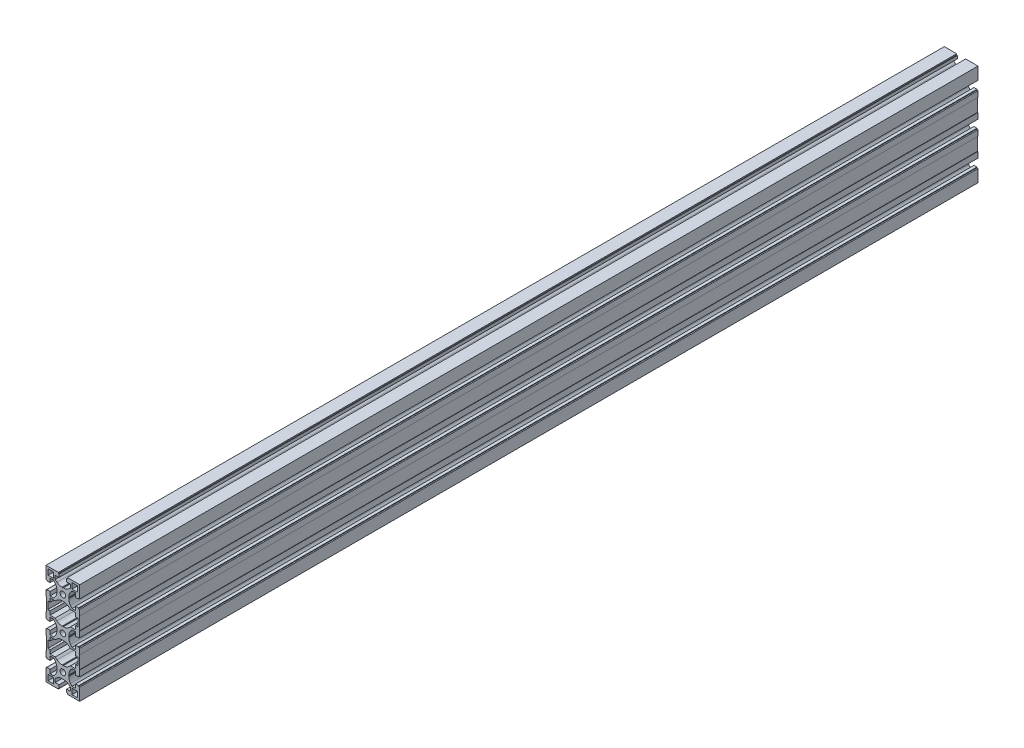
from build123d import *

# Parameters (mm, degrees)
MODEL_R             = 3.7
MODEL_W             = 7.5
MODEL_H             = 7.5
BOSS_EXTRUDE1_DEPTH = 1200


with BuildPart() as part:
    # Model → Boss-Extrude1 (new body)
    with BuildSketch(Plane.XY):
        with BuildLine():
            Line((-12.229898987, -10.25), (-10.212991588, -7.746686356))
            ThreePointArc((-10.212991588, -7.746686356), (-8.56946226, -4.799135414), (-8, -1.472732261))
            Line((-8, -1.472732261), (-8, -0.5))
            Line((-8, -0.5), (-7.5, 0))
            Line((-7.5, 0), (-8, 0.5))
            Line((-8, 0.5), (-8, 1.472732261))
            ThreePointArc((-8, 1.472732261), (-8.56946226, 4.799135414), (-10.212991588, 7.746686356))
            Line((-10.212991588, 7.746686356), (-12.229898987, 10.25))
            Line((-12.229898987, 10.25), (-17, 10.25))
            Line((-17, 10.25), (-17, 5.1))
            Line((-17, 5.1), (-21, 5.1))
            Line((-21, 5.1), (-21, 6))
            Line((-21, 6), (-22.5, 6))
            Line((-22.5, 6), (-22.5, 13.75))
            Line((-22.5, 13.75), (-22, 13.75))
            Line((-22, 13.75), (-22, 31.25))
            Line((-22, 31.25), (-22.5, 31.25))
            Line((-22.5, 31.25), (-22.5, 39))
            Line((-22.5, 39), (-21, 39))
            Line((-21, 39), (-21, 39.9))
            Line((-21, 39.9), (-17, 39.9))
            Line((-17, 39.9), (-17, 34.75))
            Line((-17, 34.75), (-12.229898987, 34.75))
            Line((-12.229898987, 34.75), (-10.212991588, 37.253313644))
            ThreePointArc((-10.212991588, 37.253313644), (-8.56946226, 40.200864586), (-8, 43.527267739))
            Line((-8, 43.527267739), (-8, 44.5))
            Line((-8, 44.5), (-7.5, 45))
            Line((-7.5, 45), (-8, 45.5))
            Line((-8, 45.5), (-8, 46.472732261))
            ThreePointArc((-8, 46.472732261), (-8.56946226, 49.799135414), (-10.212991588, 52.746686356))
            Line((-10.212991588, 52.746686356), (-12.229898987, 55.25))
            Line((-12.229898987, 55.25), (-17, 55.25))
            Line((-17, 55.25), (-17, 50.1))
            Line((-17, 50.1), (-21, 50.1))
            Line((-21, 50.1), (-21, 51))
            Line((-21, 51), (-22.5, 51))
            Line((-22.5, 51), (-22.5, 67.5))
            Line((-22.5, 67.5), (-6, 67.5))
            Line((-6, 67.5), (-6, 66))
            Line((-6, 66), (-5.1, 66))
            Line((-5.1, 66), (-5.1, 62))
            Line((-5.1, 62), (-10.25, 62))
            Line((-10.25, 62), (-10.25, 57.229898987))
            Line((-10.25, 57.229898987), (-7.746686356, 55.212991588))
            ThreePointArc((-7.746686356, 55.212991588), (-4.799135414, 53.56946226), (-1.472732261, 53))
            Line((-1.472732261, 53), (-0.5, 53))
            Line((-0.5, 53), (0, 52.5))
            Line((0, 52.5), (0.5, 53))
            Line((0.5, 53), (1.472732261, 53))
            ThreePointArc((1.472732261, 53), (4.799135414, 53.56946226), (7.746686356, 55.212991588))
            Line((7.746686356, 55.212991588), (10.25, 57.229898987))
            Line((10.25, 57.229898987), (10.25, 62))
            Line((10.25, 62), (5.1, 62))
            Line((5.1, 62), (5.1, 66))
            Line((5.1, 66), (6, 66))
            Line((6, 66), (6, 67.5))
            Line((6, 67.5), (22.5, 67.5))
            Line((22.5, 67.5), (22.5, 51))
            Line((22.5, 51), (21, 51))
            Line((21, 51), (21, 50.1))
            Line((21, 50.1), (17, 50.1))
            Line((17, 50.1), (17, 55.25))
            Line((17, 55.25), (12.229898987, 55.25))
            Line((12.229898987, 55.25), (10.212991588, 52.746686356))
            ThreePointArc((10.212991588, 52.746686356), (8.56946226, 49.799135414), (8, 46.472732261))
            Line((8, 46.472732261), (8, 45.5))
            Line((8, 45.5), (7.5, 45))
            Line((7.5, 45), (8, 44.5))
            Line((8, 44.5), (8, 43.527267739))
            ThreePointArc((8, 43.527267739), (8.56946226, 40.200864586), (10.212991588, 37.253313644))
            Line((10.212991588, 37.253313644), (12.229898987, 34.75))
            Line((12.229898987, 34.75), (17, 34.75))
            Line((17, 34.75), (17, 39.9))
            Line((17, 39.9), (21, 39.9))
            Line((21, 39.9), (21, 39))
            Line((21, 39), (22.5, 39))
            Line((22.5, 39), (22.5, 31.25))
            Line((22.5, 31.25), (22, 31.25))
            Line((22, 31.25), (22, 13.75))
            Line((22, 13.75), (22.5, 13.75))
            Line((22.5, 13.75), (22.5, 6))
            Line((22.5, 6), (21, 6))
            Line((21, 6), (21, 5.1))
            Line((21, 5.1), (17, 5.1))
            Line((17, 5.1), (17, 10.25))
            Line((17, 10.25), (12.229898987, 10.25))
            Line((12.229898987, 10.25), (10.212991588, 7.746686356))
            ThreePointArc((10.212991588, 7.746686356), (8.56946226, 4.799135414), (8, 1.472732261))
            Line((8, 1.472732261), (8, 0.5))
            Line((8, 0.5), (7.5, 0))
            Line((7.5, 0), (8, -0.5))
            Line((8, -0.5), (8, -1.472732261))
            ThreePointArc((8, -1.472732261), (8.56946226, -4.799135414), (10.212991588, -7.746686356))
            Line((10.212991588, -7.746686356), (12.229898987, -10.25))
            Line((12.229898987, -10.25), (17, -10.25))
            Line((17, -10.25), (17, -5.1))
            Line((17, -5.1), (21, -5.1))
            Line((21, -5.1), (21, -6))
            Line((21, -6), (22.5, -6))
            Line((22.5, -6), (22.5, -13.75))
            Line((22.5, -13.75), (22, -13.75))
            Line((22, -13.75), (22, -31.25))
            Line((22, -31.25), (22.5, -31.25))
            Line((22.5, -31.25), (22.5, -39))
            Line((22.5, -39), (21, -39))
            Line((21, -39), (21, -39.9))
            Line((21, -39.9), (17, -39.9))
            Line((17, -39.9), (17, -34.75))
            Line((17, -34.75), (12.229898987, -34.75))
            Line((12.229898987, -34.75), (10.212991588, -37.253313644))
            ThreePointArc((10.212991588, -37.253313644), (8.56946226, -40.200864586), (8, -43.527267739))
            Line((8, -43.527267739), (8, -44.5))
            Line((8, -44.5), (7.5, -45))
            Line((7.5, -45), (8, -45.5))
            Line((8, -45.5), (8, -46.472732261))
            ThreePointArc((8, -46.472732261), (8.56946226, -49.799135414), (10.212991588, -52.746686356))
            Line((10.212991588, -52.746686356), (12.229898987, -55.25))
            Line((12.229898987, -55.25), (17, -55.25))
            Line((17, -55.25), (17, -50.1))
            Line((17, -50.1), (21, -50.1))
            Line((21, -50.1), (21, -51))
            Line((21, -51), (22.5, -51))
            Line((22.5, -51), (22.5, -67.5))
            Line((22.5, -67.5), (6, -67.5))
            Line((6, -67.5), (6, -66))
            Line((6, -66), (5.1, -66))
            Line((5.1, -66), (5.1, -62))
            Line((5.1, -62), (10.25, -62))
            Line((10.25, -62), (10.25, -57.229898987))
            Line((10.25, -57.229898987), (7.746686356, -55.212991588))
            ThreePointArc((7.746686356, -55.212991588), (4.799135414, -53.56946226), (1.472732261, -53))
            Line((1.472732261, -53), (0.5, -53))
            Line((0.5, -53), (0, -52.5))
            Line((0, -52.5), (-0.5, -53))
            Line((-0.5, -53), (-1.472732261, -53))
            ThreePointArc((-1.472732261, -53), (-4.799135414, -53.56946226), (-7.746686356, -55.212991588))
            Line((-7.746686356, -55.212991588), (-10.25, -57.229898987))
            Line((-10.25, -57.229898987), (-10.25, -62))
            Line((-10.25, -62), (-5.1, -62))
            Line((-5.1, -62), (-5.1, -66))
            Line((-5.1, -66), (-6, -66))
            Line((-6, -66), (-6, -67.5))
            Line((-6, -67.5), (-22.5, -67.5))
            Line((-22.5, -67.5), (-22.5, -51))
            Line((-22.5, -51), (-21, -51))
            Line((-21, -51), (-21, -50.1))
            Line((-21, -50.1), (-17, -50.1))
            Line((-17, -50.1), (-17, -55.25))
            Line((-17, -55.25), (-12.229898987, -55.25))
            Line((-12.229898987, -55.25), (-10.212991588, -52.746686356))
            ThreePointArc((-10.212991588, -52.746686356), (-8.56946226, -49.799135414), (-8, -46.472732261))
            Line((-8, -46.472732261), (-8, -45.5))
            Line((-8, -45.5), (-7.5, -45))
            Line((-7.5, -45), (-8, -44.5))
            Line((-8, -44.5), (-8, -43.527267739))
            ThreePointArc((-8, -43.527267739), (-8.56946226, -40.200864586), (-10.212991588, -37.253313644))
            Line((-10.212991588, -37.253313644), (-12.229898987, -34.75))
            Line((-12.229898987, -34.75), (-17, -34.75))
            Line((-17, -34.75), (-17, -39.9))
            Line((-17, -39.9), (-21, -39.9))
            Line((-21, -39.9), (-21, -39))
            Line((-21, -39), (-22.5, -39))
            Line((-22.5, -39), (-22.5, -31.25))
            Line((-22.5, -31.25), (-22, -31.25))
            Line((-22, -31.25), (-22, -13.75))
            Line((-22, -13.75), (-22.5, -13.75))
            Line((-22.5, -13.75), (-22.5, -6))
            Line((-22.5, -6), (-21, -6))
            Line((-21, -6), (-21, -5.1))
            Line((-21, -5.1), (-17, -5.1))
            Line((-17, -5.1), (-17, -10.25))
            Line((-17, -10.25), (-12.229898987, -10.25))
        make_face()
        with Locations((0, -45)):
            Circle(MODEL_R, mode=Mode.SUBTRACT)
        with Locations((0, 45)):
            Circle(MODEL_R, mode=Mode.SUBTRACT)
        Circle(MODEL_R, mode=Mode.SUBTRACT)
        with BuildLine():
            Line((-0.5, -8), (-1.300759238, -8))
            ThreePointArc((-1.300759238, -8), (-4.770221715, -8.621149851), (-7.808672972, -10.407433976))
            Line((-7.808672972, -10.407433976), (-10.25, -12.5))
            Line((-10.25, -12.5), (-17, -12.5))
            Line((-17, -12.5), (-17, -17.5))
            Line((-17, -17.5), (-20, -17.5))
            Line((-20, -17.5), (-20, -27.5))
            Line((-20, -27.5), (-17, -27.5))
            Line((-17, -27.5), (-17, -32.5))
            Line((-17, -32.5), (-10.25, -32.5))
            Line((-10.25, -32.5), (-7.808672972, -34.592566024))
            ThreePointArc((-7.808672972, -34.592566024), (-4.770221715, -36.378850149), (-1.300759238, -37))
            Line((-1.300759238, -37), (-0.5, -37))
            Line((-0.5, -37), (0, -37.5))
            Line((0, -37.5), (0.5, -37))
            Line((0.5, -37), (1.300759238, -37))
            ThreePointArc((1.300759238, -37), (4.770221715, -36.378850149), (7.808672972, -34.592566024))
            Line((7.808672972, -34.592566024), (10.25, -32.5))
            Line((10.25, -32.5), (17, -32.5))
            Line((17, -32.5), (17, -27.5))
            Line((17, -27.5), (20, -27.5))
            Line((20, -27.5), (20, -17.5))
            Line((20, -17.5), (17, -17.5))
            Line((17, -17.5), (17, -12.5))
            Line((17, -12.5), (10.25, -12.5))
            Line((10.25, -12.5), (7.808672972, -10.407433976))
            ThreePointArc((7.808672972, -10.407433976), (4.770221715, -8.621149851), (1.300759238, -8))
            Line((1.300759238, -8), (0.5, -8))
            Line((0.5, -8), (0, -7.5))
            Line((0, -7.5), (-0.5, -8))
        make_face(mode=Mode.SUBTRACT)
        with BuildLine():
            Line((0.5, 8), (1.300759238, 8))
            ThreePointArc((1.300759238, 8), (4.770221715, 8.621149851), (7.808672972, 10.407433976))
            Line((7.808672972, 10.407433976), (10.25, 12.5))
            Line((10.25, 12.5), (17, 12.5))
            Line((17, 12.5), (17, 17.5))
            Line((17, 17.5), (20, 17.5))
            Line((20, 17.5), (20, 27.5))
            Line((20, 27.5), (17, 27.5))
            Line((17, 27.5), (17, 32.5))
            Line((17, 32.5), (10.25, 32.5))
            Line((10.25, 32.5), (7.808672972, 34.592566024))
            ThreePointArc((7.808672972, 34.592566024), (4.770221715, 36.378850149), (1.300759238, 37))
            Line((1.300759238, 37), (0.5, 37))
            Line((0.5, 37), (0, 37.5))
            Line((0, 37.5), (-0.5, 37))
            Line((-0.5, 37), (-1.300759238, 37))
            ThreePointArc((-1.300759238, 37), (-4.770221715, 36.378850149), (-7.808672972, 34.592566024))
            Line((-7.808672972, 34.592566024), (-10.25, 32.5))
            Line((-10.25, 32.5), (-17, 32.5))
            Line((-17, 32.5), (-17, 27.5))
            Line((-17, 27.5), (-20, 27.5))
            Line((-20, 27.5), (-20, 17.5))
            Line((-20, 17.5), (-17, 17.5))
            Line((-17, 17.5), (-17, 12.5))
            Line((-17, 12.5), (-10.25, 12.5))
            Line((-10.25, 12.5), (-7.808672972, 10.407433976))
            ThreePointArc((-7.808672972, 10.407433976), (-4.770221715, 8.621149851), (-1.300759238, 8))
            Line((-1.300759238, 8), (-0.5, 8))
            Line((-0.5, 8), (0, 7.5))
            Line((0, 7.5), (0.5, 8))
        make_face(mode=Mode.SUBTRACT)
        with Locations((16.05, -61.05)):
            Rectangle(MODEL_W, MODEL_H, mode=Mode.SUBTRACT)
        with Locations((-16.05, -61.05)):
            Rectangle(MODEL_W, MODEL_H, mode=Mode.SUBTRACT)
        with Locations((16.05, 61.05)):
            Rectangle(MODEL_W, MODEL_H, mode=Mode.SUBTRACT)
        with Locations((-16.05, 61.05)):
            Rectangle(MODEL_W, MODEL_H, mode=Mode.SUBTRACT)
    extrude(amount=-BOSS_EXTRUDE1_DEPTH)


solid = part.part
